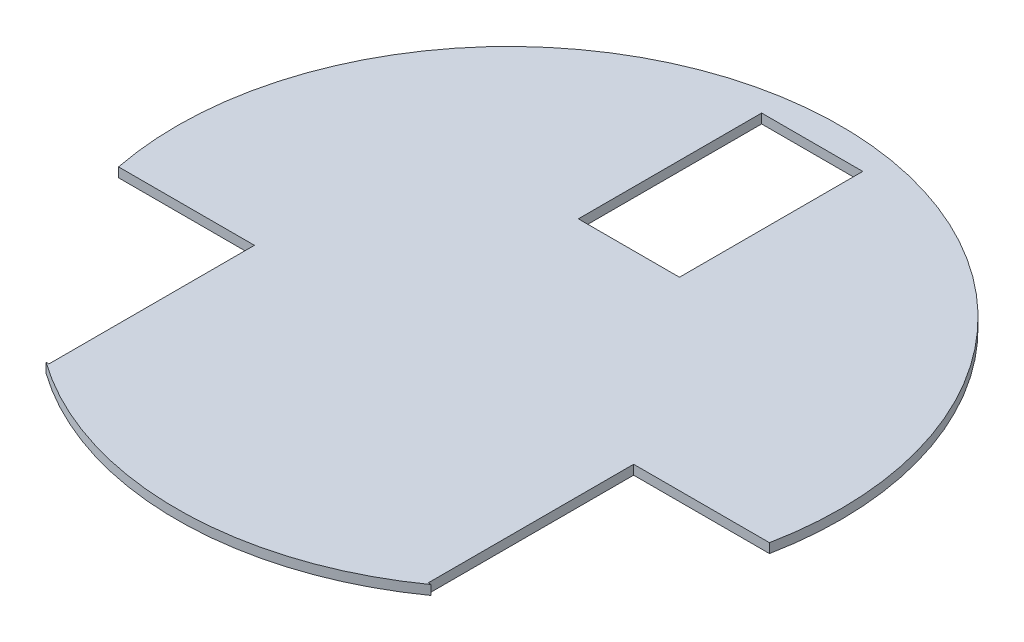
from build123d import *

# Parameters (mm, degrees)
SKETCH_1_R            = 105
EXTRUDE_359_DEPTH     = 3
CUT_EXTRUDE_769_DEPTH = 149.522725534
SKETCH_6_W            = 32
SKETCH_6_H            = 58
CUT_EXTRUDE_989_DEPTH = 149.522725534


with BuildPart() as part:
    # 草图1 → Extrude 359 (new body)
    with BuildSketch(Plane(origin=(0, 0, 0), x_dir=(1, 0, 0), z_dir=(0, 1, 0))):
        with Locations(Location((0, 0, 0), (0, 0, 270))):
            Circle(SKETCH_1_R)
    extrude(amount=EXTRUDE_359_DEPTH)

    # 草图5 → Cut-Extrude 769 (cut, through all)
    with BuildSketch(Plane(origin=(0, 3, 0), x_dir=(1, 0, 0), z_dir=(0, 1, 0))):
        with BuildLine():
            Line((-60, -20.5), (-102.979366865, -20.5))
            ThreePointArc((-102.979366865, -20.5), (-88.172313056, -57.014412304), (-60.948748962, -85.5))
            Line((-60.948748962, -85.5), (-60, -85.5))
            Line((-60, -85.5), (-60, -20.5))
        make_face()
        with BuildLine():
            ThreePointArc((60.948748962, -85.5), (88.172313056, -57.014412304), (102.979366865, -20.5))
            Line((102.979366865, -20.5), (60, -20.5))
            Line((60, -20.5), (60, -85.5))
            Line((60, -85.5), (60.948748962, -85.5))
        make_face()
    extrude(amount=-CUT_EXTRUDE_769_DEPTH, mode=Mode.SUBTRACT)

    # 草图6 → Cut-Extrude 989 (cut, through all)
    with BuildSketch(Plane(origin=(0, 3, 0), x_dir=(1, 0, 0), z_dir=(0, 1, 0))):
        with Locations((0, 67)):
            Rectangle(SKETCH_6_W, SKETCH_6_H)
    extrude(amount=-CUT_EXTRUDE_989_DEPTH, mode=Mode.SUBTRACT)


solid = part.part
